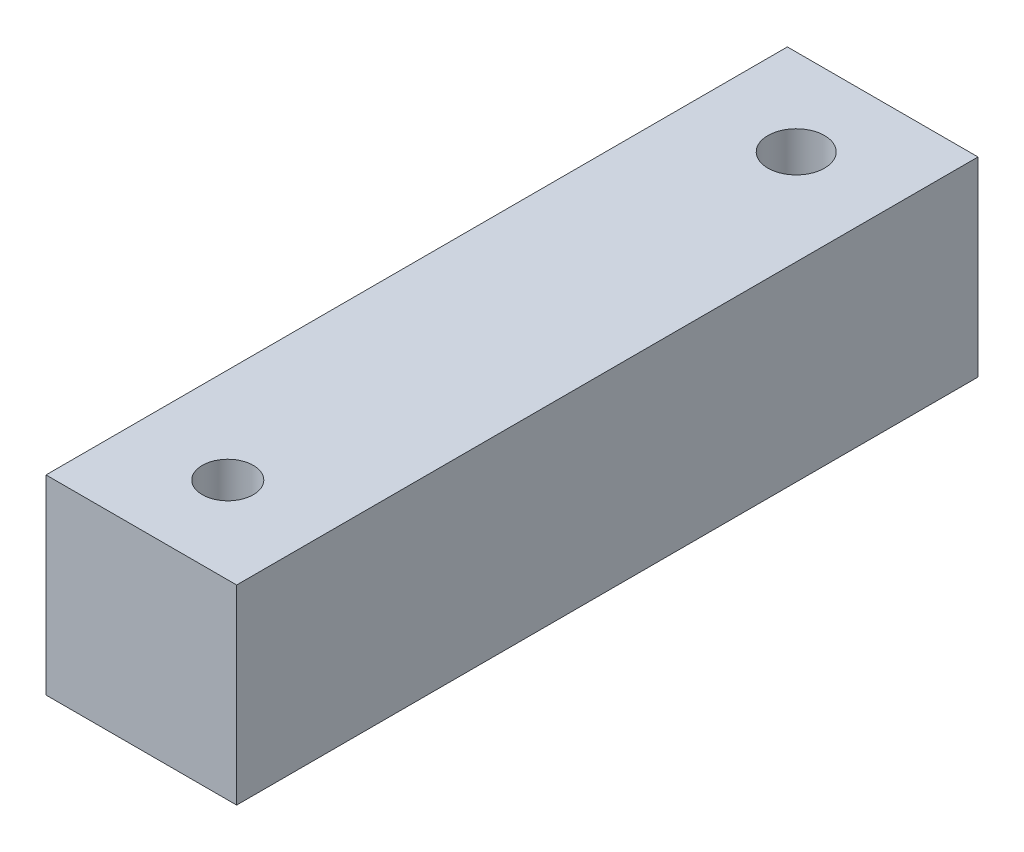
from build123d import *

# Parameters (mm, degrees)
ESQUISSE1_W             = 18
ESQUISSE1_H             = 18
BOSS_EXTRU_1_DEPTH      = 70
ESQUISSE4_R             = 2.407143036
ESQUISSE4_R_2           = 2.672945279
ENL_V_MAT_EXTRU_1_DEPTH = 50


with BuildPart() as part:
    # Esquisse1 → Boss.-Extru.1 (new body)
    with BuildSketch(Plane.XY):
        with Locations((9, 9)):
            Rectangle(ESQUISSE1_W, ESQUISSE1_H)
    extrude(amount=BOSS_EXTRU_1_DEPTH)

    # Esquisse4 → Enlèv. mat.-Extru.1 (cut)
    with BuildSketch(Plane(origin=(0, 18, 0), x_dir=(1, 0, 0), z_dir=(0, 1, 0))):
        with Locations(Location((9, -61.835951373, 0), (0, 0, 270))):
            Circle(ESQUISSE4_R)
        with Locations(Location((9, -8.164048627, 0), (0, 0, 270))):
            Circle(ESQUISSE4_R_2)
    extrude(amount=-ENL_V_MAT_EXTRU_1_DEPTH, mode=Mode.SUBTRACT)


solid = part.part
